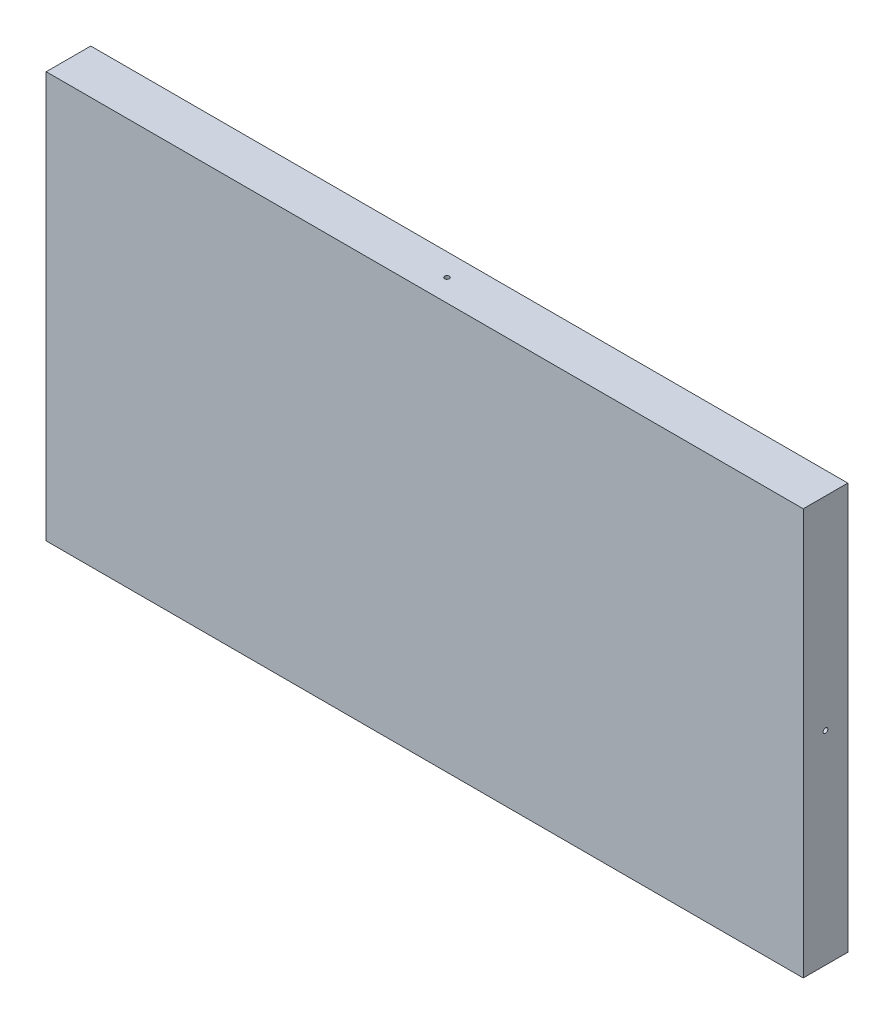
from build123d import *

# Parameters (mm, degrees)
SKETCH_1_W         = 680
SKETCH_1_H         = 365
EXTRUDE_1_DEPTH    = 40
HOLE_WIZARD_M5_1_D = 4.2
HOLE_WIZARD_M5_2_D = 4.2


with BuildPart() as part:
    # 草图1 → 凸台-拉伸1 (new body)
    with BuildSketch(Plane.XY):
        Rectangle(SKETCH_1_W, SKETCH_1_H)
    extrude(amount=EXTRUDE_1_DEPTH)

    # M5 螺纹孔1 (through all)
    with Locations(Plane(origin=(0, -182.5, 0), x_dir=(-1, 0, 0), z_dir=(0, -1, 0))):
        with Locations((0, -20)):
            Hole(HOLE_WIZARD_M5_1_D / 2)

    # M5 螺纹孔2 (through all)
    with Locations(Plane.ZY.offset(340)):
        with Locations((20, 0)):
            Hole(HOLE_WIZARD_M5_2_D / 2)


solid = part.part
